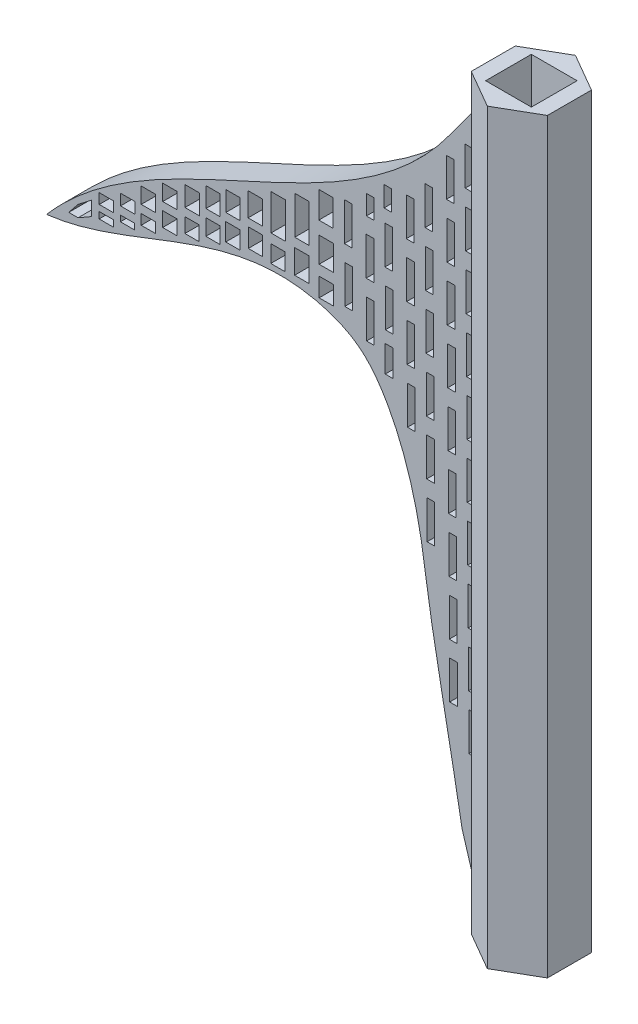
from build123d import *

# Parameters (mm, degrees)
BOSS_EXTRUDE1_DEPTH = 5.08
SKETCH2_W           = 1.27
SKETCH2_H           = 6.35
SKETCH2_H_2         = 3.26647072
SKETCH2_W_2         = 2.385016114
SKETCH2_H_3         = 4.429063964
SKETCH2_H_4         = 4.201710601
SKETCH2_W_3         = 2.385016113
SKETCH2_H_5         = 3.121516191
SKETCH2_H_6         = 4.001968024
SKETCH2_H_7         = 5.98711735
SKETCH2_H_8         = 3.92582552
SKETCH2_H_9         = 2.868282419
SKETCH2_H_10        = 3.126169588
SKETCH2_H_11        = 3.315838096
SKETCH2_H_12        = 2.946435119
SKETCH2_H_13        = 2.697298641
SKETCH2_H_14        = 2.435275424
SKETCH2_H_15        = 3.315838095
SKETCH2_H_16        = 2.65442209
SKETCH2_H_17        = 1.842999351
SKETCH2_H_18        = 3.391703628
SKETCH2_H_19        = 4.416676079
SKETCH2_H_20        = 1.699456158
SKETCH2_H_21        = 0.97492215
SKETCH2_H_22        = 1.709538389
SKETCH2_H_23        = 1.079130466
CUT_EXTRUDE1_DEPTH  = 154.669669535
SKETCH3_W           = 7.62
SKETCH3_H           = 7.62
BOSS_EXTRUDE3_DEPTH = 124.46


with BuildPart() as part:
    # Sketch1 → Boss-Extrude1 (new body)
    with BuildSketch(Plane.XY):
        with BuildLine():
            Line((0.585067847, 135.310357514), (0.585067847, 14.660357514))
            Line((0.585067847, 14.660357514), (-3.41725996, 27.923958873))
            add(Edge.make_bspline(
                [(-72.661324249, 81.976723343), (-59.124143019, 83.593012304), (-42.903605681, 95.756986572), (-21.631794428, 90.645926118), (-14.63720054, 82.948376917), (-10.723613271, 70.946630178), (-8.616504769, 54.509487238), (-4.989783713, 37.022132016), (-3.41725996, 27.923958873)],
                knots=[0, 0, 0, 0, 0.357138862, 0.424069671, 0.534017456, 0.754057558, 0.800655812, 1, 1, 1, 1], degree=3))
            add(Edge.make_bspline(
                [(-5.360333192, 127.197336757), (-22.249981765, 103.754249171), (-54.212294503, 103.457943025), (-72.661324249, 81.976723343)],
                knots=[0, 0, 0, 0, 1, 1, 1, 1], degree=3))
            Line((-5.360333192, 127.197336757), (0.585067847, 135.310357514))
        make_face()
    extrude(amount=BOSS_EXTRUDE1_DEPTH)

    # Sketch2 → Cut-Extrude1 (cut, through all)
    with BuildSketch(Plane.XY.offset(5.08)):
        with Locations((-8.959862708, 114.791376879)):
            Rectangle(SKETCH2_W, SKETCH2_H)
        with Locations((-15.64558996, 105.758277201)):
            Rectangle(SKETCH2_W, SKETCH2_H)
        with Locations((-18.742987542, 110.031203385)):
            Rectangle(SKETCH2_W, SKETCH2_H_2)
        with Locations((-26.101960738, 106.059094508)):
            Rectangle(SKETCH2_W_2, SKETCH2_H_3)
        with Locations((-26.052982985, 99.599254273)):
            Rectangle(SKETCH2_W_2, SKETCH2_H_4)
        with Locations((-26.048269946, 94.215313178)):
            Rectangle(SKETCH2_W_3, SKETCH2_H_5)
        with Locations((-18.773943842, 102.583277201)):
            Rectangle(SKETCH2_W, SKETCH2_H)
        with Locations((-15.577958413, 96.725177524)):
            Rectangle(SKETCH2_W, SKETCH2_H)
        with Locations((-12.020585044, 102.583277201)):
            Rectangle(SKETCH2_W, SKETCH2_H)
        with Locations((-8.824599614, 96.725177524)):
            Rectangle(SKETCH2_W, SKETCH2_H)
        with Locations((-11.952953496, 93.550177524)):
            Rectangle(SKETCH2_W, SKETCH2_H)
        with Locations((-5.131963151, 84.517077846)):
            Rectangle(SKETCH2_W, SKETCH2_H)
        with Locations((-11.885321949, 84.517077846)):
            Rectangle(SKETCH2_W, SKETCH2_H)
        with Locations((-8.621704973, 69.625878492)):
            Rectangle(SKETCH2_W, SKETCH2_H)
        with Locations((-4.996700056, 66.450878492)):
            Rectangle(SKETCH2_W, SKETCH2_H)
        with Locations((-30.139582572, 95.868483951)):
            Rectangle(SKETCH2_W_2, SKETCH2_H_6)
        with Locations((-34.075135518, 100.990450344)):
            Rectangle(SKETCH2_W_2, SKETCH2_H_7)
        with Locations((-37.886481741, 100.234890654)):
            Rectangle(SKETCH2_W_2, SKETCH2_H_8)
        with Locations((-34.10755434, 95.018151522)):
            Rectangle(SKETCH2_W_2, SKETCH2_H_9)
        with Locations((-37.851503634, 95.440423017)):
            Rectangle(SKETCH2_W_3, SKETCH2_H_10)
        with Locations((-41.598267108, 98.855106169)):
            Rectangle(SKETCH2_W_3, SKETCH2_H_11)
        with Locations((-41.611074547, 94.406088135)):
            Rectangle(SKETCH2_W_2, SKETCH2_H_12)
        with Locations((-44.925095388, 93.43640014)):
            Rectangle(SKETCH2_W_2, SKETCH2_H_13)
        with Locations((-48.411495107, 91.972026596)):
            Rectangle(SKETCH2_W_2, SKETCH2_H_14)
        with Locations((-48.398687669, 96.165464782)):
            Rectangle(SKETCH2_W_2, SKETCH2_H_15)
        with Locations((-52.122453165, 90.98491602)):
            Rectangle(SKETCH2_W_2, SKETCH2_H_14)
        with Locations((-52.109645727, 94.847646203)):
            Rectangle(SKETCH2_W_2, SKETCH2_H_16)
        with Locations((-55.691066183, 92.641560442)):
            Rectangle(SKETCH2_W_2, SKETCH2_H_16)
        with Locations((-59.148385438, 90.284649206)):
            Rectangle(SKETCH2_W_2, SKETCH2_H_17)
        with Locations((-5.334857792, 111.616376879)):
            Rectangle(SKETCH2_W, SKETCH2_H)
        with Locations((-5.402489339, 120.649476556)):
            Rectangle(SKETCH2_W, SKETCH2_H)
        with Locations((-2.274135457, 123.824476556)):
            Rectangle(SKETCH2_W, SKETCH2_H)
        with Locations((-2.20650391, 114.791376879)):
            Rectangle(SKETCH2_W, SKETCH2_H)
        with Locations((-2.138872363, 105.758277201)):
            Rectangle(SKETCH2_W, SKETCH2_H)
        with Locations((-5.267226245, 102.583277201)):
            Rectangle(SKETCH2_W, SKETCH2_H)
        with Locations((-8.892231161, 105.758277201)):
            Rectangle(SKETCH2_W, SKETCH2_H)
        with Locations((-12.088216591, 111.616376879)):
            Rectangle(SKETCH2_W, SKETCH2_H)
        with Locations((-15.796784197, 112.722386625)):
            Rectangle(SKETCH2_W, SKETCH2_H_18)
        with Locations((-22.398948758, 105.758277201)):
            Rectangle(SKETCH2_W, SKETCH2_H)
        with Locations((-22.331317211, 96.725177524)):
            Rectangle(SKETCH2_W, SKETCH2_H)
        with Locations((-18.706312295, 93.550177524)):
            Rectangle(SKETCH2_W, SKETCH2_H)
        with Locations((-15.597873811, 89.3658614)):
            Rectangle(SKETCH2_W, SKETCH2_H_19)
        with Locations((-5.199594698, 93.550177524)):
            Rectangle(SKETCH2_W, SKETCH2_H)
        with Locations((-2.071240816, 96.725177524)):
            Rectangle(SKETCH2_W, SKETCH2_H)
        with Locations((-8.756968067, 87.692077846)):
            Rectangle(SKETCH2_W, SKETCH2_H)
        with Locations((-2.003609268, 87.692077846)):
            Rectangle(SKETCH2_W, SKETCH2_H)
        with Locations((-1.935977721, 78.658978169)):
            Rectangle(SKETCH2_W, SKETCH2_H)
        with Locations((-5.064331604, 75.483978169)):
            Rectangle(SKETCH2_W, SKETCH2_H)
        with Locations((-8.68933652, 78.658978169)):
            Rectangle(SKETCH2_W, SKETCH2_H)
        with Locations((-1.868346174, 69.625878492)):
            Rectangle(SKETCH2_W, SKETCH2_H)
        with Locations((-1.665451533, 42.526579459)):
            Rectangle(SKETCH2_W, SKETCH2_H)
        with Locations((-1.73308308, 51.559679137)):
            Rectangle(SKETCH2_W, SKETCH2_H)
        with Locations((-1.800714627, 60.592778814)):
            Rectangle(SKETCH2_W, SKETCH2_H)
        with Locations((-4.929068509, 57.417778814)):
            Rectangle(SKETCH2_W, SKETCH2_H)
        with Locations((-4.861436962, 48.384679137)):
            Rectangle(SKETCH2_W, SKETCH2_H)
        with Locations((-30.110818292, 102.541050755)):
            Rectangle(SKETCH2_W_2, SKETCH2_H)
        with Locations((-44.912287949, 97.760849933)):
            Rectangle(SKETCH2_W_2, SKETCH2_H_15)
        with Locations((-55.703873622, 89.146739892)):
            Rectangle(SKETCH2_W_3, SKETCH2_H_20)
        with Locations((-59.161192877, 87.557807029)):
            Rectangle(SKETCH2_W_2, SKETCH2_H_21)
        with Locations((-62.688474697, 88.65893316)):
            Rectangle(SKETCH2_W_2, SKETCH2_H_22)
        with Locations((-62.701282136, 86.248369726)):
            Rectangle(SKETCH2_W_2, SKETCH2_H_23)
        Polygon((-65.141339051, 85.430350939), (-67.408346522, 84.124503825), (-68.959094054, 84.124503825), (-67.408346522, 86.055447599), (-65.141339051, 87.804163966), align=None)
    extrude(amount=-CUT_EXTRUDE1_DEPTH, mode=Mode.SUBTRACT)

    # Sketch3 → Boss-Extrude3 (add)
    with BuildSketch(Plane(origin=(0, 14.660357514, 0), x_dir=(1, 0, 0), z_dir=(0, 1, 0))):
        Polygon((11.922427184, -6.213772506), (11.931203974, 1.11857066), (5.585596918, 4.792343166), (-0.768786928, 1.133772506), (-0.777563718, -6.19857066), (5.568043338, -9.872343166), align=None)
        with Locations((5.576820128, -2.54)):
            Rectangle(SKETCH3_W, SKETCH3_H, mode=Mode.SUBTRACT)
    extrude(amount=BOSS_EXTRUDE3_DEPTH)


solid = part.part
